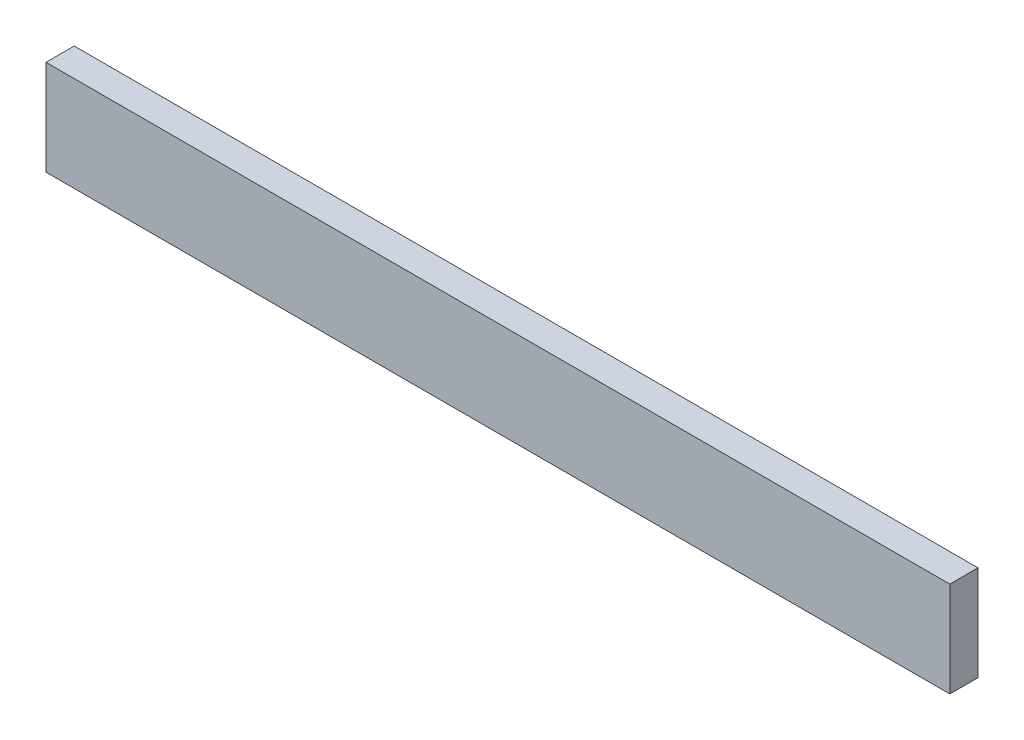
from build123d import *

# Parameters (mm, degrees)
SKETCH_1_W      = 256.45534
SKETCH_1_H      = 27
EXTRUDE_1_DEPTH = 8


with BuildPart() as part:
    # 草图1 → 凸台-拉伸1 (new body)
    with BuildSketch(Plane.XY):
        with Locations((-12.716150225, 65.012989561)):
            Rectangle(SKETCH_1_W, SKETCH_1_H)
    extrude(amount=EXTRUDE_1_DEPTH)


solid = part.part
